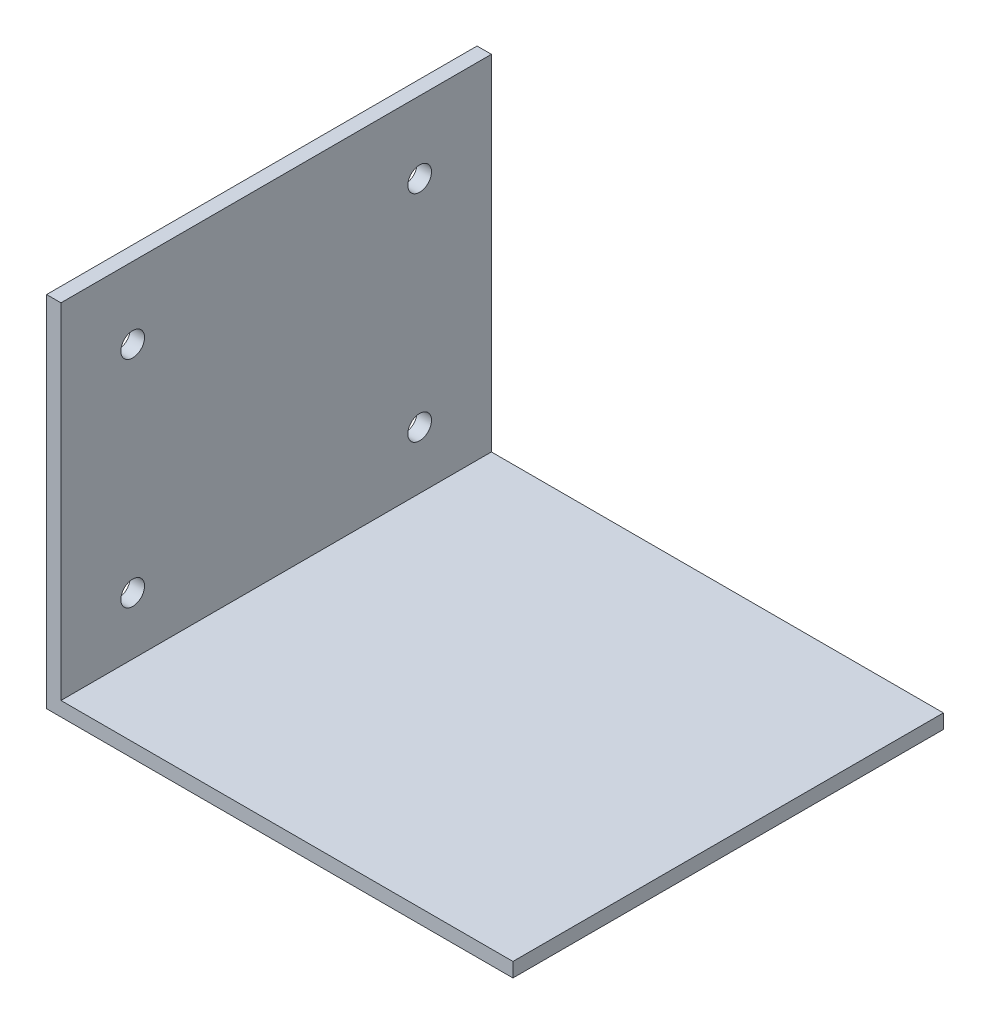
from build123d import *

# Parameters (mm, degrees)
BOSS_EXTRUDE1_DEPTH = 120
SKETCH4_R           = 3.3
CUT_EXTRUDE1_DEPTH  = 201.688813839


with BuildPart() as part:
    # Sketch2 → Boss-Extrude1 (new body)
    with BuildSketch(Plane.XY):
        Polygon((0, 0), (0, 100), (4, 100), (4, 4), (130, 4), (130, 0), align=None)
    extrude(amount=BOSS_EXTRUDE1_DEPTH)

    # Sketch4 → Cut-Extrude1 (cut, through all)
    with BuildSketch(Plane(origin=(4, 0, 0), x_dir=(0, 0, -1), z_dir=(1, 0, 0))):
        with Locations(Location((-100, 80, 0), (0, 0, 90))):
            Circle(SKETCH4_R)
        with Locations(Location((-20, 80, 0), (0, 0, 90))):
            Circle(SKETCH4_R)
        with Locations(Location((-20, 20, 0), (0, 0, 90))):
            Circle(SKETCH4_R)
        with Locations(Location((-100, 20, 0), (0, 0, 90))):
            Circle(SKETCH4_R)
    extrude(amount=-CUT_EXTRUDE1_DEPTH, mode=Mode.SUBTRACT)


solid = part.part
